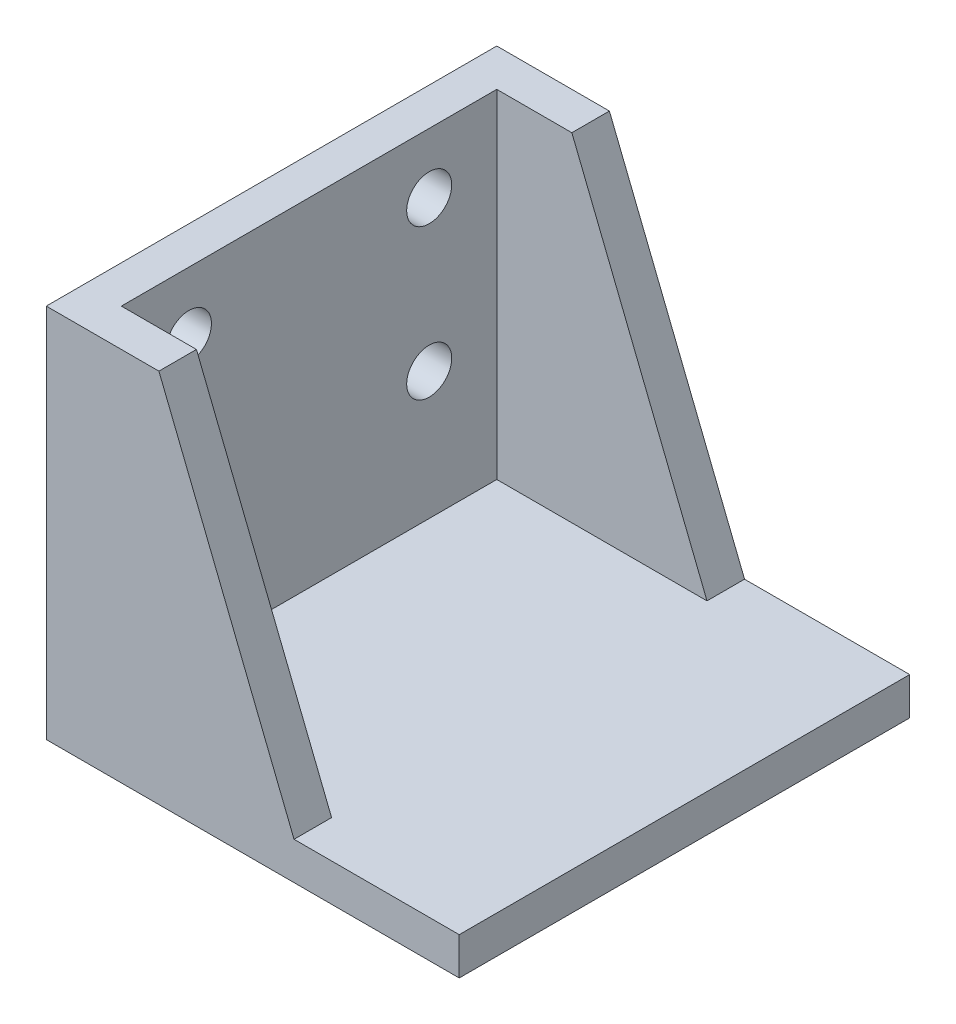
from build123d import *

# Parameters (mm, degrees)
EXTRUDE_1_DEPTH     = 60
SKETCH_2_W          = 34.644902364
SKETCH_2_H          = 50
CUT_EXTRUDE_1_DEPTH = 45
SKETCH_3_R          = 3
SKETCH_3_R_2        = 2.5
CUT_EXTRUDE_2_DEPTH = 91.891477881
SKETCH_4_R          = 3
CUT_EXTRUDE_3_DEPTH = 82.627431502
SKETCH_5_W          = 60
SKETCH_5_H          = 5
EXTRUDE_2_DEPTH     = 50


with BuildPart() as part:
    # 草图1 → 凸台-拉伸1 (new body)
    with BuildSketch(Plane.XY):
        Polygon((-11.489361702, -7.127659574), (-46.489361702, -7.127659574), (-46.489361702, 42.872340426), (-31.489361702, 42.872340426), align=None)
    extrude(amount=EXTRUDE_1_DEPTH)

    # 草图2 → 切除-拉伸1 (cut)
    with BuildSketch(Plane(origin=(0, 42.872340426, 0), x_dir=(1, 0, 0), z_dir=(0, 1, 0))):
        with Locations((-24.16691052, -30)):
            Rectangle(SKETCH_2_W, SKETCH_2_H)
    extrude(amount=-CUT_EXTRUDE_1_DEPTH, mode=Mode.SUBTRACT)

    # 草图3 → 切除-拉伸2 (cut, through all)
    with BuildSketch(Plane.XZ.offset(7.127659574)):
        with Locations((-35.489361702, 48)):
            Circle(SKETCH_3_R)
        with Locations(Location((-35.489361702, 12, 0), (0, 0, 270))):
            Circle(SKETCH_3_R)
        with Locations(Location((-19.489361702, 12, 0), (0, 0, 270))):
            Circle(SKETCH_3_R_2)
        with Locations((-19.489361702, 48)):
            Circle(SKETCH_3_R_2)
    extrude(amount=-CUT_EXTRUDE_2_DEPTH, mode=Mode.SUBTRACT)

    # 草图4 → 切除-拉伸3 (cut, through all)
    with BuildSketch(Plane.ZY.offset(46.489361702)):
        with Locations((14, 34.872340426)):
            Circle(SKETCH_4_R)
        with Locations((46, 34.872340426)):
            Circle(SKETCH_4_R)
        with Locations((14, 14.872340426)):
            Circle(SKETCH_4_R)
        with Locations((46, 14.872340426)):
            Circle(SKETCH_4_R)
    extrude(amount=-CUT_EXTRUDE_3_DEPTH, mode=Mode.SUBTRACT)

    # 草图5 → 凸台-拉伸2 (add)
    with BuildSketch(Plane(origin=(-41.489361702, 0, 0), x_dir=(0, 0, -1), z_dir=(1, 0, 0))):
        with Locations((-30, -4.627659574)):
            Rectangle(SKETCH_5_W, SKETCH_5_H)
    extrude(amount=EXTRUDE_2_DEPTH)


solid = part.part
